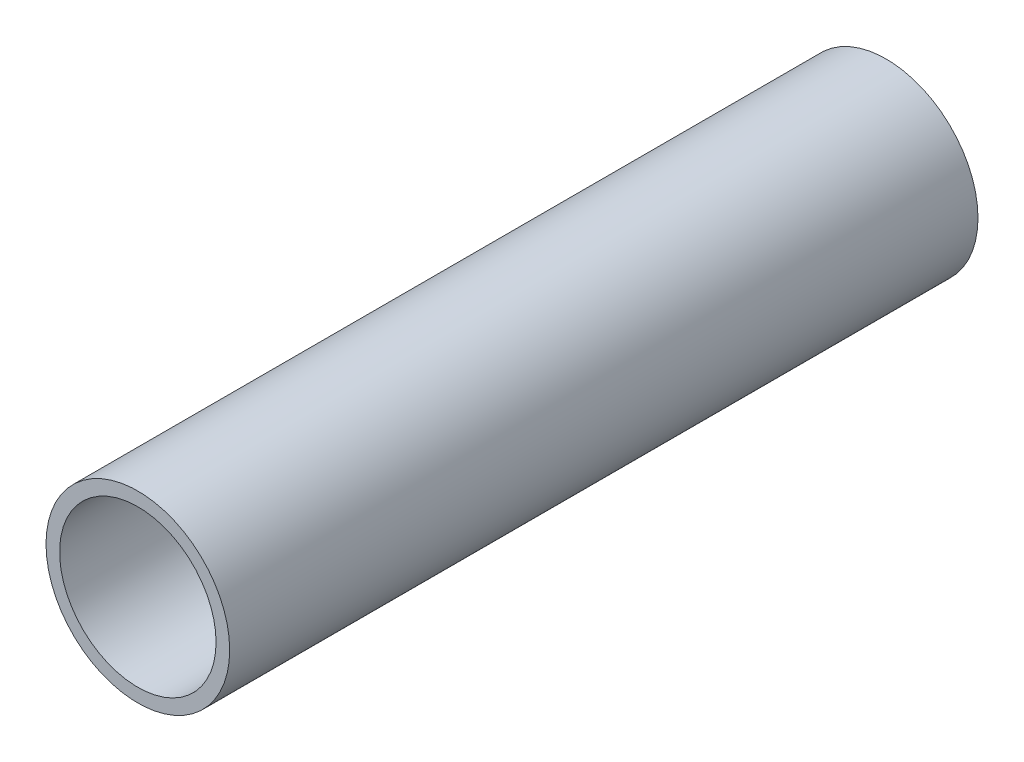
from build123d import *

# Parameters (mm, degrees)
AICAD_SKETCH_F001_R           = 13.5
AICAD_F001_BASE_EXTRUDE_DEPTH = 110
AICAD_SKETCH_F002_R           = 11.5
AICAD_F002_CUT_EXTRUDE_DEPTH  = 112.644525168


with BuildPart() as part:
    # AICAD_SKETCH_F001 → AICAD_F001_BASE_EXTRUDE (new body)
    with BuildSketch(Plane.XY):
        Circle(AICAD_SKETCH_F001_R)
    extrude(amount=AICAD_F001_BASE_EXTRUDE_DEPTH)

    # AICAD_SKETCH_F002 → AICAD_F002_CUT_EXTRUDE (cut, through all)
    with BuildSketch(Plane.XY.offset(110)):
        Circle(AICAD_SKETCH_F002_R)
    extrude(amount=-AICAD_F002_CUT_EXTRUDE_DEPTH, mode=Mode.SUBTRACT)


solid = part.part
